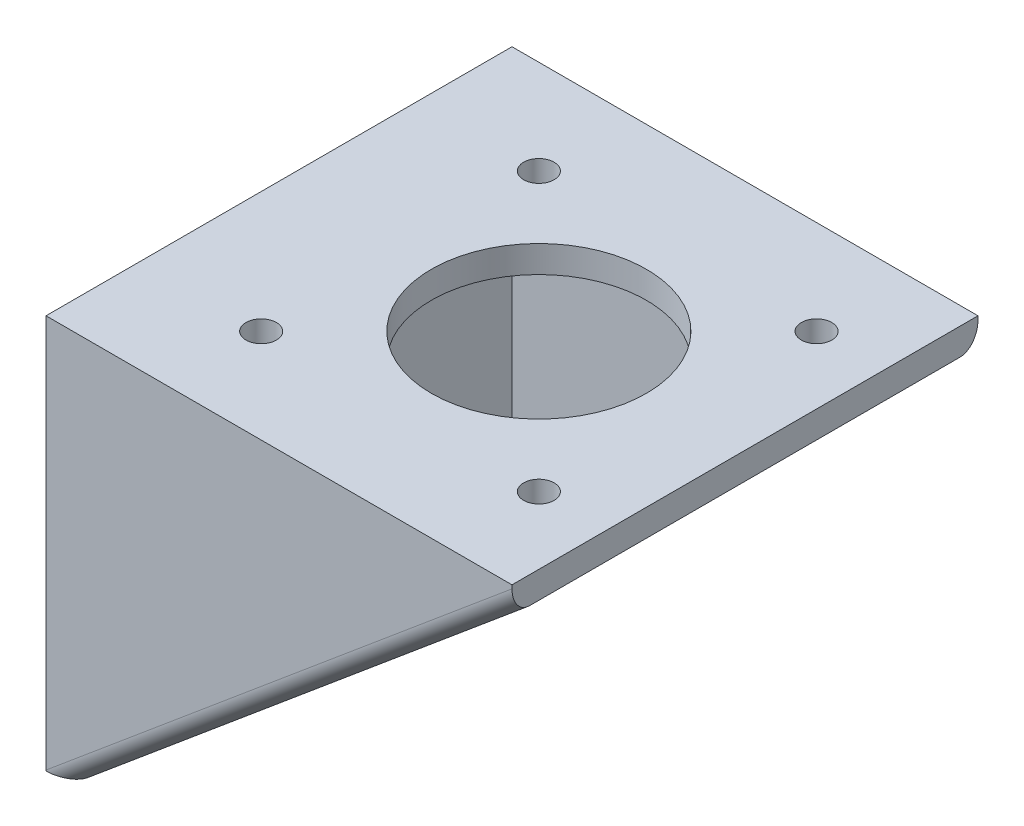
from build123d import *

# Parameters (mm, degrees)
SKETCH1_W            = 52
SKETCH1_H            = 52
SKETCH1_R            = 12
BOSS_EXTRUDE1_DEPTH  = 3
SKETCH2_W            = 52
SKETCH2_H            = 41
BOSS_EXTRUDE2_DEPTH  = 3
M3_CLEARANCE_HOLE1_D = 3.4
M4_CLEARANCE_HOLE1_D = 4.5
BOSS_EXTRUDE3_DEPTH  = 3
BOSS_EXTRUDE4_DEPTH  = 3
FILLET1_R            = 2


with BuildPart() as part:
    # Sketch1 → Boss-Extrude1 (new body)
    with BuildSketch(Plane(origin=(0, 0, 0), x_dir=(1, 0, 0), z_dir=(0, 1, 0))):
        with Locations((-3, 0)):
            Rectangle(SKETCH1_W, SKETCH1_H)
        with Locations(Location((0, 0, 0), (0, 0, 270))):
            Circle(SKETCH1_R, mode=Mode.SUBTRACT)
    extrude(amount=BOSS_EXTRUDE1_DEPTH)

    # Sketch2 → Boss-Extrude2 (add)
    with BuildSketch(Plane.ZY.offset(29)):
        with Locations((0, -20.5)):
            Rectangle(SKETCH2_W, SKETCH2_H)
    extrude(amount=-BOSS_EXTRUDE2_DEPTH)

    # M3 Clearance Hole1 (through all)
    with Locations(Plane(origin=(0, 3, 0), x_dir=(1, 0, 0), z_dir=(0, 1, 0))):
        with Locations((15.494, -15.494), (-15.494, -15.494), (-15.494, 15.494), (15.494, 15.494)):
            Hole(M3_CLEARANCE_HOLE1_D / 2)

    # M4 Clearance Hole1 (through all)
    with Locations(Plane(origin=(-26, 0, 0), x_dir=(0, 0, -1), z_dir=(1, 0, 0))):
        with Locations((-10, -9), (10, -9), (10, -31), (-10, -31), (0, -9), (0, -31)):
            Hole(M4_CLEARANCE_HOLE1_D / 2)

    # Sketch7 → Boss-Extrude3 (add)
    with BuildSketch(Plane(origin=(0, 0, -26), x_dir=(-1, 0, 0), z_dir=(0, 0, -1))):
        Polygon((26, -41), (-23, 0), (26, 0), align=None)
    extrude(amount=-BOSS_EXTRUDE3_DEPTH)

    # Sketch8 → Boss-Extrude4 (add)
    with BuildSketch(Plane.XY.offset(26)):
        Polygon((23, 0), (-26, -41), (-26, 0), align=None)
    extrude(amount=-BOSS_EXTRUDE4_DEPTH)

    # Fillet1
    fillet1_edges = [part.edges().sort_by_distance(p)[0] for p in [
        (-1.5, -20.5, 26),
        (-1.5, -20.5, -26),
    ]]
    fillet(fillet1_edges, radius=FILLET1_R)


solid = part.part
